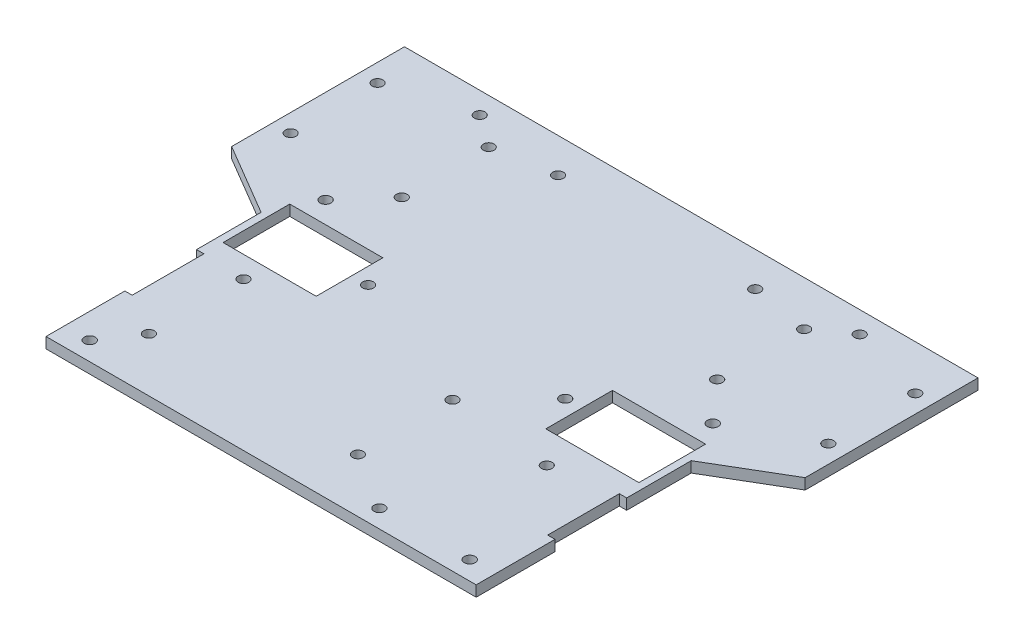
from build123d import *

# Parameters (mm, degrees)
SKETCH1_W           = 120
SKETCH1_H           = 120
BOSS_EXTRUDE1_DEPTH = 3
SKETCH2_R           = 1.5
CUT_EXTRUDE1_DEPTH  = 101.04498988
SKETCH3_R           = 1.5
CUT_EXTRUDE3_DEPTH  = 101.04498988
SKETCH4_R           = 1.5
CUT_EXTRUDE4_DEPTH  = 101.04498988
SKETCH6_R           = 1.525
CUT_EXTRUDE7_DEPTH  = 101.04498988
SKETCH10_W          = 25.970420931
SKETCH10_H          = 18.602515671
CUT_EXTRUDE9_DEPTH  = 5
SKETCH11_R          = 1.5
CUT_EXTRUDE10_DEPTH = 5
SKETCH12_W          = 2.05
SKETCH12_H          = 20
CUT_EXTRUDE11_DEPTH = 10


with BuildPart() as part:
    # Sketch1 → Boss-Extrude1 (new body)
    with BuildSketch(Plane(origin=(0, 0, 0), x_dir=(1, 0, 0), z_dir=(0, 1, 0))):
        Rectangle(SKETCH1_W, SKETCH1_H)
        Polygon((-80, 11.791828604), (-60, 0), (-60, 60), (-80, 60), align=None)
        Polygon((80, 60), (60, 60), (60, 0), (80, 11.791828604), align=None)
    extrude(amount=BOSS_EXTRUDE1_DEPTH)

    # Sketch2 → Cut-Extrude1 (cut, through all)
    with BuildSketch(Plane(origin=(0, 3, 0), x_dir=(1, 0, 0), z_dir=(0, 1, 0))):
        with Locations(Location((28, -55, 0), (0, 0, 270))):
            Circle(SKETCH2_R)
        with Locations(Location((41, -21.300528194, 0), (0, 0, 270))):
            Circle(SKETCH2_R)
        with Locations(Location((-46.29, -45, 0), (0, 0, 270))):
            Circle(SKETCH2_R)
        with Locations(Location((12, -45, 0), (0, 0, 270))):
            Circle(SKETCH2_R)
        with Locations(Location((-46.29, -18.6, 0), (0, 0, 270))):
            Circle(SKETCH2_R)
        with Locations(Location((12, -18.6, 0), (0, 0, 270))):
            Circle(SKETCH2_R)
    extrude(amount=-CUT_EXTRUDE1_DEPTH, mode=Mode.SUBTRACT)

    # Sketch3 → Cut-Extrude3 (cut, through all)
    with BuildSketch(Plane(origin=(0, 3, 0), x_dir=(1, 0, 0), z_dir=(0, 1, 0))):
        with Locations(Location((-27.529579069, 50.385555627, 0), (0, 0, 270))):
            Circle(SKETCH3_R)
        with Locations(Location((-27.529579069, -2.614444373, 0), (0, 0, 90))):
            Circle(SKETCH3_R)
        with Locations(Location((27.470420931, -2.614444373, 0), (0, 0, 270))):
            Circle(SKETCH3_R)
        with Locations(Location((27.470420931, 50.385555627, 0), (0, 0, 90))):
            Circle(SKETCH3_R)
    extrude(amount=-CUT_EXTRUDE3_DEPTH, mode=Mode.SUBTRACT)

    # Sketch4 → Cut-Extrude4 (cut, through all)
    with BuildSketch(Plane(origin=(0, 3, 0), x_dir=(1, 0, 0), z_dir=(0, 1, 0))):
        with Locations(Location((-75, 23.24, 0), (0, 0, 270))):
            Circle(SKETCH4_R)
        with Locations(Location((-75, 47.5, 0), (0, 0, 270))):
            Circle(SKETCH4_R)
        with Locations(Location((-44, 23.24, 0), (0, 0, 90))):
            Circle(SKETCH4_R)
        with Locations(Location((-44, 47.5, 0), (0, 0, 90))):
            Circle(SKETCH4_R)
        with Locations(Location((44, 47.5, 0), (0, 0, 270))):
            Circle(SKETCH4_R)
        with Locations(Location((44, 23.24, 0), (0, 0, 270))):
            Circle(SKETCH4_R)
        with Locations(Location((75, 23.24, 0), (0, 0, 90))):
            Circle(SKETCH4_R)
        with Locations(Location((75, 47.5, 0), (0, 0, 90))):
            Circle(SKETCH4_R)
    extrude(amount=-CUT_EXTRUDE4_DEPTH, mode=Mode.SUBTRACT)

    # Sketch6 → Cut-Extrude7 (cut, through all)
    with BuildSketch(Plane(origin=(0, 3, 0), x_dir=(1, 0, 0), z_dir=(0, 1, 0))):
        with Locations(Location((-53, -54.8, 0), (0, 0, 270))):
            Circle(SKETCH6_R)
        with Locations(Location((53, -54.8, 0), (0, 0, 90))):
            Circle(SKETCH6_R)
        with Locations(Location((-54, 12.002515671, 0), (0, 0, 270))):
            Circle(SKETCH6_R)
        with Locations(Location((54, 12.002515671, 0), (0, 0, 90))):
            Circle(SKETCH6_R)
    extrude(amount=-CUT_EXTRUDE7_DEPTH, mode=Mode.SUBTRACT)

    # Sketch10 → Cut-Extrude9 (cut)
    with BuildSketch(Plane(origin=(0, 3, 0), x_dir=(1, 0, 0), z_dir=(0, 1, 0))):
        with Locations((-45.014789535, -3.298742165)):
            Rectangle(SKETCH10_W, SKETCH10_H)
        with Locations((45.014789535, -3.298742165)):
            Rectangle(SKETCH10_W, SKETCH10_H)
    extrude(amount=-CUT_EXTRUDE9_DEPTH, mode=Mode.SUBTRACT)

    # Sketch11 → Cut-Extrude10 (cut)
    with BuildSketch(Plane(origin=(0, 3, 0), x_dir=(1, 0, 0), z_dir=(0, 1, 0))):
        with Locations(Location((-53, 54, 0), (0, 0, 270))):
            Circle(SKETCH11_R)
        with Locations(Location((53, 54, 0), (0, 0, 270))):
            Circle(SKETCH11_R)
    extrude(amount=-CUT_EXTRUDE10_DEPTH, mode=Mode.SUBTRACT)

    # Sketch12 → Cut-Extrude11 (cut)
    with BuildSketch(Plane(origin=(0, 3, 0), x_dir=(1, 0, 0), z_dir=(0, 1, 0))):
        with Locations((-58.975, -28)):
            Rectangle(SKETCH12_W, SKETCH12_H)
        with Locations((58.975, -28)):
            Rectangle(SKETCH12_W, SKETCH12_H)
    extrude(amount=-CUT_EXTRUDE11_DEPTH, mode=Mode.SUBTRACT)


solid = part.part
